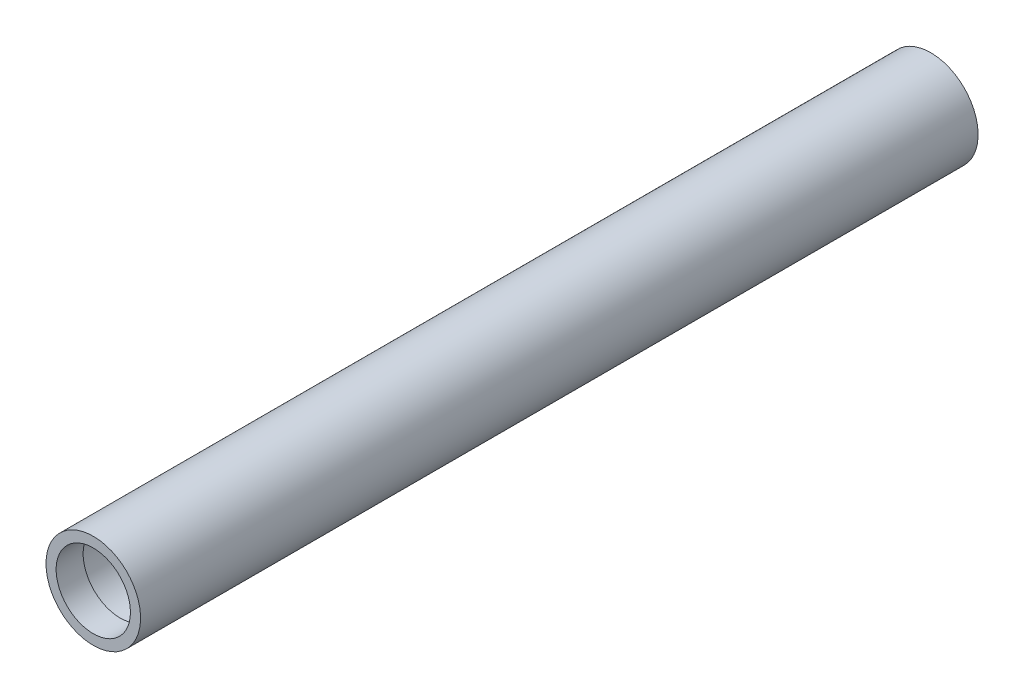
from build123d import *

# Parameters (mm, degrees)
SKETCH1_R           = 4.445
SKETCH1_R_2         = 3.81
BOSS_EXTRUDE1_DEPTH = 76.2
SKETCH2_R           = 4.445
SKETCH2_R_2         = 3.4925
BOSS_EXTRUDE2_DEPTH = 2.54


with BuildPart() as part:
    # Sketch1 → Boss-Extrude1 (new body)
    with BuildSketch(Plane.XY):
        with Locations(Location((0, 0, 0), (0, 0, 180))):
            Circle(SKETCH1_R)
        with Locations(Location((0, 0, 0), (0, 0, 180))):
            Circle(SKETCH1_R_2, mode=Mode.SUBTRACT)
    extrude(amount=BOSS_EXTRUDE1_DEPTH)

    # Sketch2 → Boss-Extrude2 (add)
    with BuildSketch(Plane.XY.offset(76.2)):
        with Locations(Location((0, 0, 0), (0, 0, 180))):
            Circle(SKETCH2_R)
        Circle(SKETCH2_R_2, mode=Mode.SUBTRACT)
    extrude(amount=BOSS_EXTRUDE2_DEPTH)


solid = part.part
